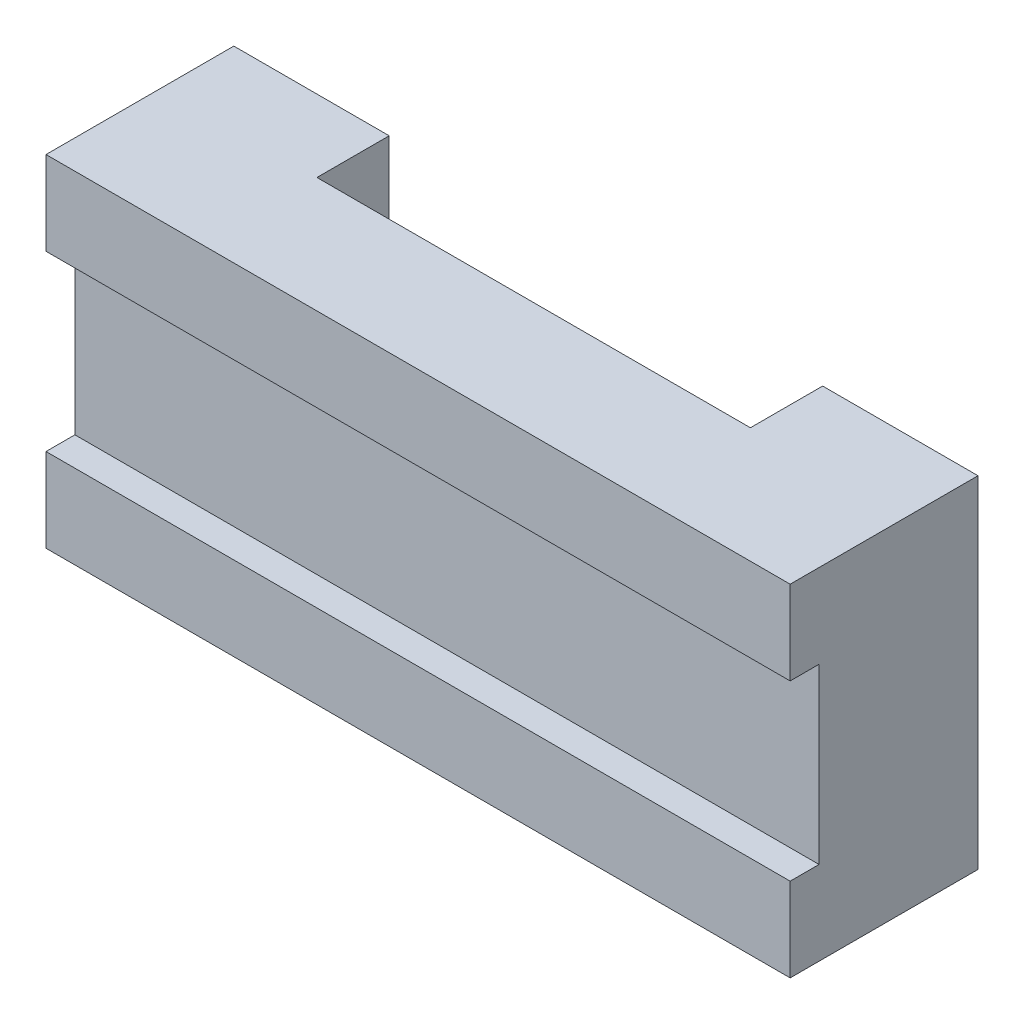
from build123d import *

# Parameters (mm, degrees)
CROQUIS2_W              = 51.502836605
CROQUIS2_H              = 23.6
SALIENTE_EXTRUIR1_DEPTH = 11
CROQUIS4_W              = 2
CROQUIS4_H              = 5.8
SALIENTE_EXTRUIR2_DEPTH = 51.502837
CORTAR_EXTRUIR1_START   = -23.6
CORTAR_EXTRUIR1_DEPTH   = 23.6


with BuildPart() as part:
    # Croquis2 → Saliente-Extruir1 (new body)
    with BuildSketch(Plane.XY):
        with Locations((49.751418302, 20)):
            Rectangle(CROQUIS2_W, CROQUIS2_H)
    extrude(amount=SALIENTE_EXTRUIR1_DEPTH)

    # Croquis4 → Saliente-Extruir2 (add)
    with BuildSketch(Plane(origin=(75.502836605, 0, 0), x_dir=(0, 0, -1), z_dir=(1, 0, 0))):
        with Locations((-12, 11.1)):
            Rectangle(CROQUIS4_W, CROQUIS4_H)
        with Locations((-12, 28.9)):
            Rectangle(CROQUIS4_W, CROQUIS4_H)
    extrude(amount=-SALIENTE_EXTRUIR2_DEPTH)

    # Croquis5 → Cortar-Extruir1 (cut)
    with BuildSketch(Plane.XZ.offset(-8.2).offset(CORTAR_EXTRUIR1_START)):
        Polygon((49.751418302, 0), (34.751418302, 0), (34.751418302, 5), (49.751418302, 5), (64.751418302, 5), (64.751418302, 0), align=None)
    extrude(amount=CORTAR_EXTRUIR1_DEPTH, mode=Mode.SUBTRACT)


solid = part.part
